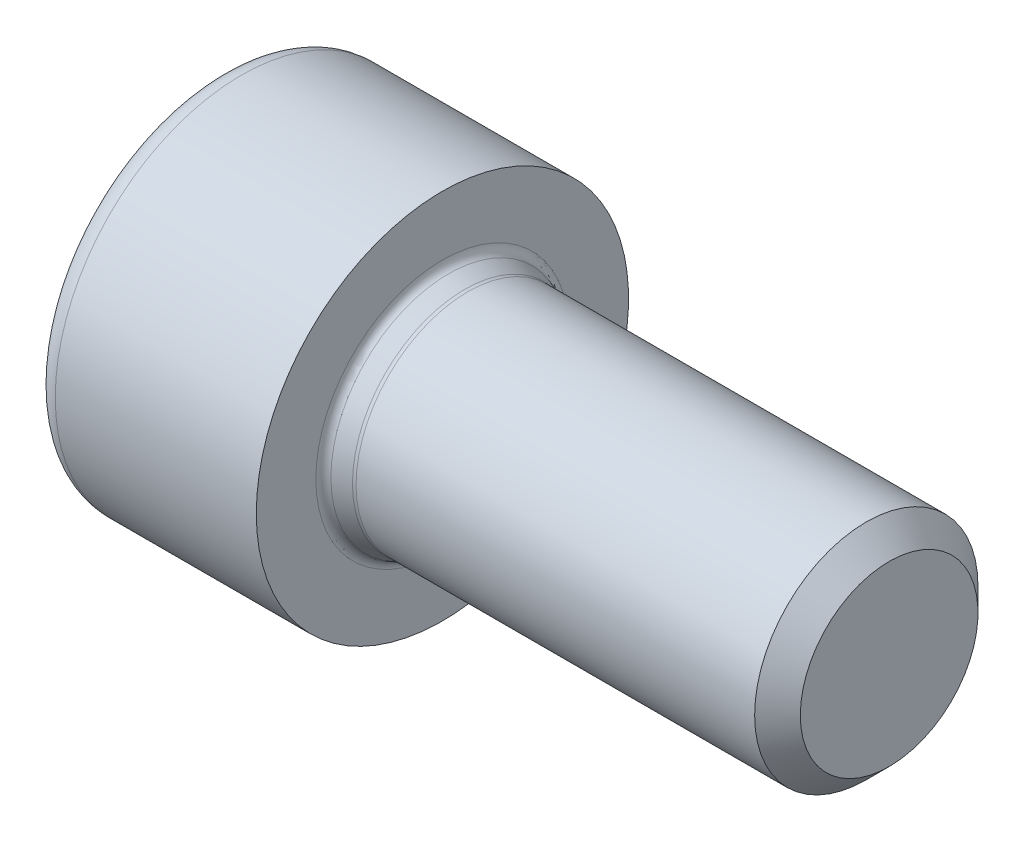
from build123d import *

# Parameters (mm, degrees)
CUT_EXTRUDE_1_DEPTH = 6
SKETCH_3_R          = 3.75
EXTRUDE_1_DEPTH     = 3


with BuildPart() as part:
    # 草图1 → 旋转1 (revolve)
    with BuildSketch(Plane.XY, mode=Mode.PRIVATE) as revolve_1_sk:
        with BuildLine():
            Line((-0.856624327, 0), (-2.3, 2.5))
            Line((-2.3, 2.5), (-6, 2.5))
            Line((-6, 2.5), (-6, 4.4))
            ThreePointArc((-6, 4.4), (-5.824264069, 4.824264069), (-5.4, 5))
            Line((-5.4, 5), (0, 5))
            Line((0, 5), (0, 3.4))
            ThreePointArc((0, 3.4), (0.046179295, 3.255234258), (0.167656961, 3.163949955))
            Line((0.167656961, 3.163949955), (0.597656961, 3.013949955))
            ThreePointArc((0.597656961, 3.013949955), (0.638241835, 3.003512159), (0.68, 3))
            Line((0.68, 3), (11.3865, 3))
            Line((11.3865, 3), (12, 2.3865))
            Line((12, 2.3865), (12, 0))
            Line((12, 0), (-0.856624327, 0))
        make_face()
    revolve(revolve_1_sk.sketch.rotate(Axis((12, 0, 0), (-1, 0, 0)), 270), axis=Axis((12, 0, 0), (-1, 0, 0)))

    # 草图2 → 切除-拉伸1 (cut)
    with BuildSketch(Plane(origin=(-2.3, 0, 0), x_dir=(0, 0, -1), z_dir=(1, 0, 0))):
        Polygon((-2.5, 1.443375673), (-2.5, -1.443375673), (0, -2.886751346), (2.5, -1.443375673), (2.5, 1.443375673), (0, 2.886751346), align=None)
    extrude(amount=-CUT_EXTRUDE_1_DEPTH, mode=Mode.SUBTRACT)


with BuildPart() as body_2:
    # 草图3 → 凸台-拉伸1 (new body)
    with BuildSketch(Plane(origin=(0, 0, 0), x_dir=(0, 0, -1), z_dir=(1, 0, 0))):
        Circle(SKETCH_3_R)
    extrude(amount=-EXTRUDE_1_DEPTH)

    # Delete Face 1: 1 face struck out; the rest of the skin is kept as a surface, the solid goes
    delete_face_1_1_drop = [body_2.part.faces().sort_by_distance(Vector(p))[0] for p in ((-3, 0, 0),)]
    delete_face_1_1 = Shell(body_2.part.faces() - delete_face_1_1_drop)


solid = part.part
